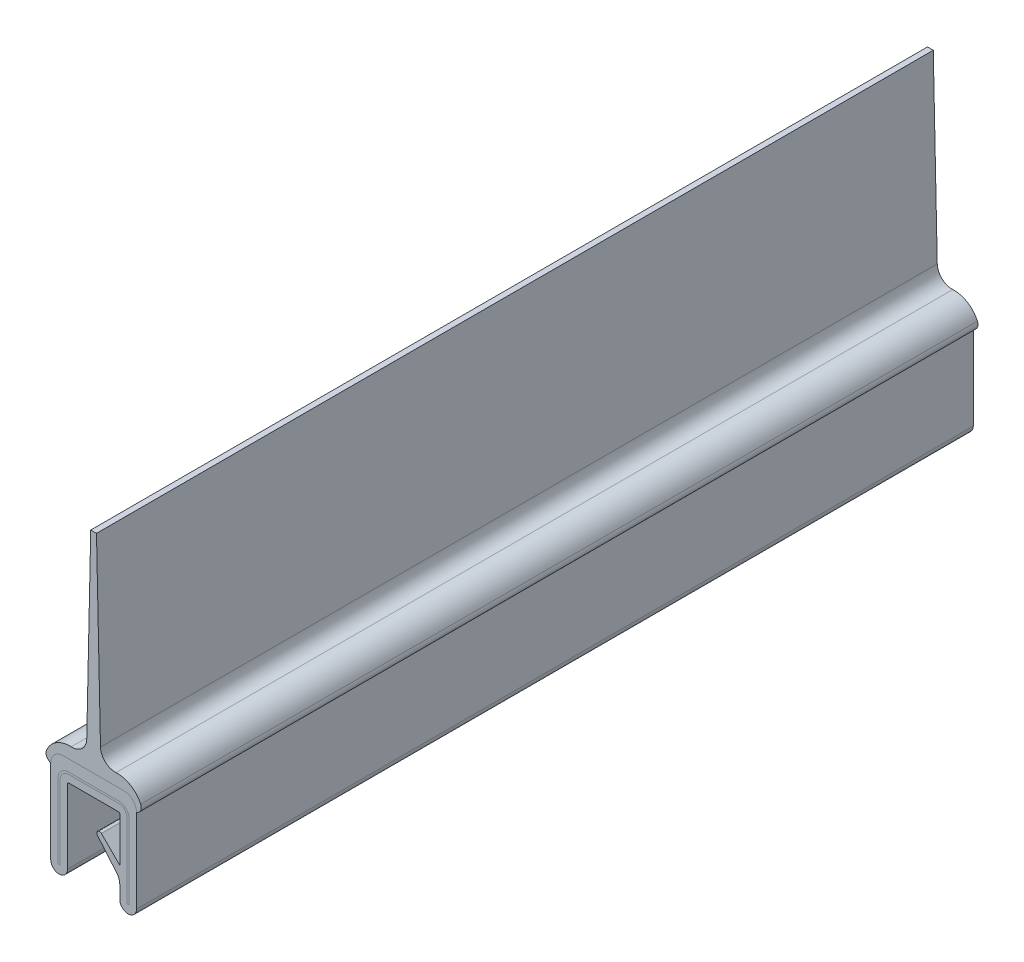
from build123d import *

# Parameters (mm, degrees)
BOSS_EXTRUDE1_DEPTH      = 152.4
BOSS_EXTRUDE1_DEPTH_BACK = 152.4
BOSS_EXTRUDE2_DEPTH      = 152.4
BOSS_EXTRUDE2_DEPTH_BACK = 152.4
FILLET1_R                = 0.79375
CUT_EXTRUDE1_DEPTH       = 155.610348225
CUT_EXTRUDE1_DEPTH_BACK  = 155.610348225
BOSS_EXTRUDE3_DEPTH      = 152.4
BOSS_EXTRUDE3_DEPTH_BACK = 152.4
FILLET2_RADIUS           = 1.016
FILLET2_LENGTH           = 304.8
FILLET3_RADIUS           = 1.016
FILLET3_LENGTH           = 304.8
CUT_EXTRUDE2_DEPTH       = 155.610348225
CUT_EXTRUDE2_DEPTH_BACK  = 155.610348225
SKETCH6_W                = 203.2
SKETCH6_H                = 38.1


with BuildPart() as part:
    # Sketch4 → Boss-Extrude1 (new, two sides: drawn at the far end of the back side and taken through both)
    with BuildSketch(Plane.XY.offset(-BOSS_EXTRUDE1_DEPTH_BACK)):
        with BuildLine():
            Line((-5.207, -12.7), (-3.175, -12.7))
            Line((-3.175, -12.7), (-3.175, -2.667))
            ThreePointArc((-3.175, -2.667), (-3.137802561, -2.577197439), (-3.048, -2.54))
            Line((-3.048, -2.54), (3.048, -2.54))
            ThreePointArc((3.048, -2.54), (3.137802561, -2.577197439), (3.175, -2.667))
            Line((3.175, -2.667), (3.175, -8.088159021))
            Line((3.175, -8.088159021), (0.948361947, -5.861520968))
            ThreePointArc((0.948361947, -5.861520968), (0.498727791, -5.851709916), (0.46931331, -6.300488167))
            Line((0.46931331, -6.300488167), (2.803595553, -9.082377417))
            ThreePointArc((2.803595553, -9.082377417), (3.079262035, -9.559845769), (3.175, -10.102802747))
            Line((3.175, -10.102802747), (3.175, -12.7))
            Line((3.175, -12.7), (5.207, -12.7))
            Line((5.207, -12.7), (5.207, -1.524))
            ThreePointArc((5.207, -1.524), (4.760630735, -0.446369265), (3.683, 0))
            Line((3.683, 0), (-3.683, 0))
            ThreePointArc((-3.683, 0), (-4.760630735, -0.446369265), (-5.207, -1.524))
            Line((-5.207, -1.524), (-5.207, -12.7))
        make_face()
    extrude(amount=BOSS_EXTRUDE1_DEPTH + BOSS_EXTRUDE1_DEPTH_BACK)

    # Sketch5 → Cut-Extrude1 (cut, two sides: drawn at the far end of the back side and taken through both)
    with BuildSketch(Plane.XY.offset(-CUT_EXTRUDE1_DEPTH_BACK)):
        with BuildLine():
            Line((4.318, -11.684), (4.318, -2.667))
            ThreePointArc((4.318, -2.667), (3.946025612, -1.768974388), (3.048, -1.397))
            Line((3.048, -1.397), (-3.048, -1.397))
            ThreePointArc((-3.048, -1.397), (-3.946025612, -1.768974388), (-4.318, -2.667))
            Line((-4.318, -2.667), (-4.318, -11.684))
            Line((-4.318, -11.684), (-4.064, -11.684))
            Line((-4.064, -11.684), (-4.064, -2.667))
            ThreePointArc((-4.064, -2.667), (-3.76642049, -1.94857951), (-3.048, -1.651))
            Line((-3.048, -1.651), (3.048, -1.651))
            ThreePointArc((3.048, -1.651), (3.76642049, -1.94857951), (4.064, -2.667))
            Line((4.064, -2.667), (4.064, -11.684))
            Line((4.064, -11.684), (4.318, -11.684))
        make_face()
    extrude(amount=CUT_EXTRUDE1_DEPTH + CUT_EXTRUDE1_DEPTH_BACK, mode=Mode.SUBTRACT)

    # Fillet2: full round fillet: the end face becomes a half cylinder, R = half its width
    fillet2_face = Plane((4.191, -12.7, 0), x_dir=(0, 0, 1), z_dir=(0, -1, 0))  # on the end face: x along it, z out of the body
    fillet2_slab = fillet2_face.offset(-FILLET2_RADIUS / 2) * Box(FILLET2_LENGTH, 2 * FILLET2_RADIUS, FILLET2_RADIUS, mode=Mode.PRIVATE)  # the body's end, R deep
    fillet2_round = Plane((4.191, -11.684, 0), x_dir=(0, -1, 0), z_dir=(0, 0, 1)) * Cylinder(FILLET2_RADIUS, FILLET2_LENGTH, mode=Mode.PRIVATE)  # its axis R under the face
    add(fillet2_slab - fillet2_round, mode=Mode.SUBTRACT)

    # Fillet3: full round fillet: the end face becomes a half cylinder, R = half its width
    fillet3_face = Plane((-4.191, -12.7, 0), x_dir=(0, 0, 1), z_dir=(0, -1, 0))  # on the end face: x along it, z out of the body
    fillet3_slab = fillet3_face.offset(-FILLET3_RADIUS / 2) * Box(FILLET3_LENGTH, 2 * FILLET3_RADIUS, FILLET3_RADIUS, mode=Mode.PRIVATE)  # the body's end, R deep
    fillet3_round = Plane((-4.191, -11.684, 0), x_dir=(0, -1, 0), z_dir=(0, 0, 1)) * Cylinder(FILLET3_RADIUS, FILLET3_LENGTH, mode=Mode.PRIVATE)  # its axis R under the face
    add(fillet3_slab - fillet3_round, mode=Mode.SUBTRACT)


with BuildPart() as body_2:
    # Sketch3 → Boss-Extrude2 (new, two sides: drawn at the far end of the back side and taken through both)
    with BuildSketch(Plane.XY.offset(-BOSS_EXTRUDE2_DEPTH_BACK)):
        with BuildLine():
            Line((3.683, 0), (-3.683, 0))
            ThreePointArc((-3.683, 0), (-4.760630735, -0.446369265), (-5.207, -1.524))
            Line((-5.207, -1.524), (-5.930511184, -1.106280623))
            ThreePointArc((-5.930511184, -1.106280623), (-4.801606302, 0.762), (-2.721270401, 1.423136341))
            ThreePointArc((-2.721270401, 1.423136341), (-1.407478061, 1.900010596), (-0.834886247, 3.175))
            Line((-0.834886247, 3.175), (-0.34925, 25.4))
            Line((-0.34925, 25.4), (0.34925, 25.4))
            Line((0.34925, 25.4), (0.834886247, 3.175))
            ThreePointArc((0.834886247, 3.175), (1.407478061, 1.900010596), (2.721270401, 1.423136341))
            ThreePointArc((2.721270401, 1.423136341), (4.801606302, 0.762), (5.930511184, -1.106280623))
            Line((5.930511184, -1.106280623), (5.207, -1.524))
            ThreePointArc((5.207, -1.524), (4.760630735, -0.446369265), (3.683, 0))
        make_face()
    extrude(amount=BOSS_EXTRUDE2_DEPTH + BOSS_EXTRUDE2_DEPTH_BACK)

    # Fillet1
    fillet1_edges = [body_2.edges().sort_by_distance(p)[0] for p in [
        (5.930511184, -1.106280623, 0),
        (-5.930511184, -1.106280623, 0),
    ]]
    fillet(fillet1_edges, radius=FILLET1_R)


with BuildPart() as body_3:
    # Sketch5<2> → Boss-Extrude3 (new, two sides: drawn at the far end of the back side and taken through both)
    with BuildSketch(Plane.XY.offset(-BOSS_EXTRUDE3_DEPTH_BACK)):
        with BuildLine():
            Line((4.318, -11.684), (4.318, -2.667))
            ThreePointArc((4.318, -2.667), (3.946025612, -1.768974388), (3.048, -1.397))
            Line((3.048, -1.397), (-3.048, -1.397))
            ThreePointArc((-3.048, -1.397), (-3.946025612, -1.768974388), (-4.318, -2.667))
            Line((-4.318, -2.667), (-4.318, -11.684))
            Line((-4.318, -11.684), (-4.064, -11.684))
            Line((-4.064, -11.684), (-4.064, -2.667))
            ThreePointArc((-4.064, -2.667), (-3.76642049, -1.94857951), (-3.048, -1.651))
            Line((-3.048, -1.651), (3.048, -1.651))
            ThreePointArc((3.048, -1.651), (3.76642049, -1.94857951), (4.064, -2.667))
            Line((4.064, -2.667), (4.064, -11.684))
            Line((4.064, -11.684), (4.318, -11.684))
        make_face()
    extrude(amount=BOSS_EXTRUDE3_DEPTH + BOSS_EXTRUDE3_DEPTH_BACK)


with BuildPart() as cut_extrude2_tool:
    # Sketch6 → Cut-Extrude2 (new, two sides: drawn at the far end of the back side and taken through both)
    with BuildSketch(Plane(origin=(0, 0, 0), x_dir=(0, 0, -1), z_dir=(1, 0, 0)).offset(-CUT_EXTRUDE2_DEPTH_BACK)):
        with Locations((50.8, 6.35)):
            Rectangle(SKETCH6_W, SKETCH6_H)
    extrude(amount=CUT_EXTRUDE2_DEPTH + CUT_EXTRUDE2_DEPTH_BACK)


with BuildPart() as part_1:
    add(part.part)

    # Cut-Extrude2: cut by cut_extrude2_tool
    add(cut_extrude2_tool.part, mode=Mode.SUBTRACT)


with BuildPart() as body_2_1:
    add(body_2.part)

    # Cut-Extrude2: cut by cut_extrude2_tool
    add(cut_extrude2_tool.part, mode=Mode.SUBTRACT)


with BuildPart() as body_3_1:
    add(body_3.part)

    # Cut-Extrude2: cut by cut_extrude2_tool
    add(cut_extrude2_tool.part, mode=Mode.SUBTRACT)


solid = Compound([part_1.part, body_2_1.part, body_3_1.part])
